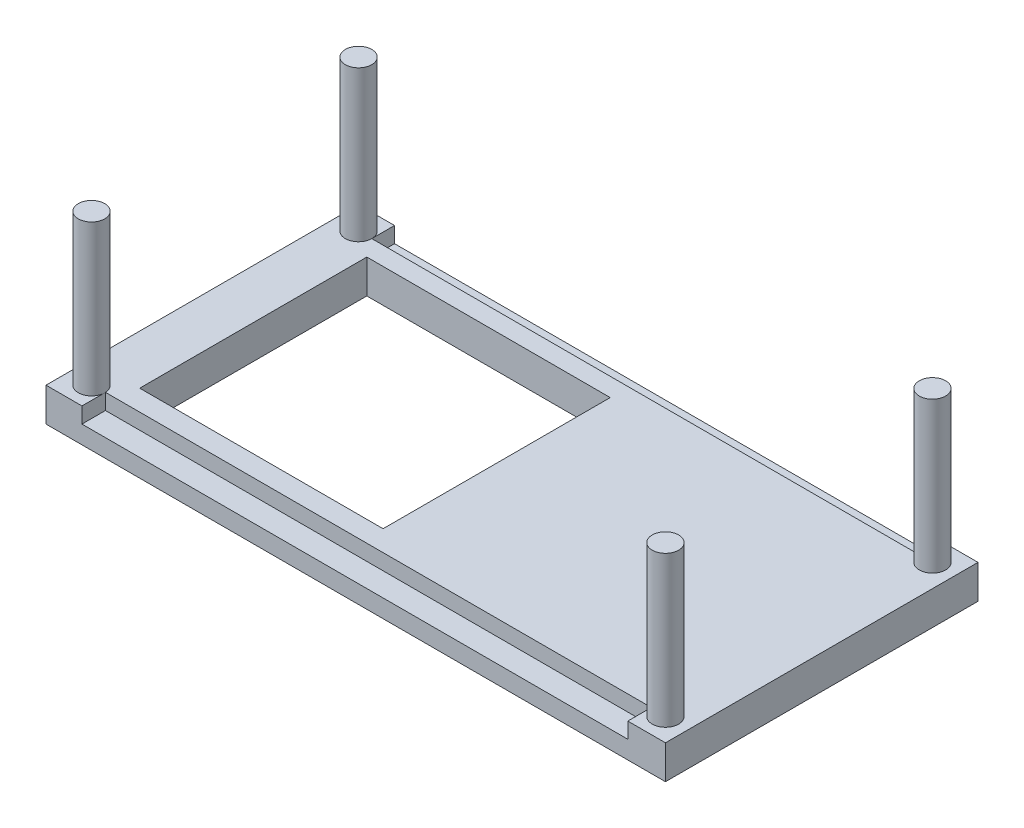
from build123d import *

# Parameters (mm, degrees)
SKETCH1_W           = 55.1
SKETCH1_H           = 27.8
BOSS_EXTRUDE1_DEPTH = 3
SKETCH2_R           = 1.175
BOSS_EXTRUDE2_DEPTH = 13.4
SKETCH3_W           = 21.65
SKETCH3_H           = 20.203759547
SKETCH3_W_2         = 17.65
SKETCH3_H_2         = 15.75
CUT_EXTRUDE1_DEPTH  = 35.945278651
SKETCH6_W           = 48.551877831
SKETCH6_H           = 2.091403142
SKETCH6_W_2         = 48.7
SKETCH6_H_2         = 4.58395526
CUT_EXTRUDE2_DEPTH  = 1.4


with BuildPart() as part:
    # Sketch1 → Boss-Extrude1 (new body)
    with BuildSketch(Plane(origin=(0, 0, 0), x_dir=(1, 0, 0), z_dir=(0, 1, 0))):
        Rectangle(SKETCH1_W, SKETCH1_H)
    extrude(amount=BOSS_EXTRUDE1_DEPTH)

    # Sketch2 → Boss-Extrude2 (add)
    with BuildSketch(Plane(origin=(0, 3, 0), x_dir=(1, 0, 0), z_dir=(0, 1, 0))):
        with Locations(Location((-25.525, 11.875, 0), (0, 0, 270))):
            Circle(SKETCH2_R)
        with Locations(Location((-25.525, -11.875, 0), (0, 0, 270))):
            Circle(SKETCH2_R)
        with Locations(Location((25.525, 11.875, 0), (0, 0, 270))):
            Circle(SKETCH2_R)
        with Locations(Location((25.525, -11.875, 0), (0, 0, 270))):
            Circle(SKETCH2_R)
    extrude(amount=BOSS_EXTRUDE2_DEPTH)

    # Sketch3 → Cut-Extrude1 (cut, through all)
    # profile 1 of 2: a face of its own
    with BuildSketch(Plane.XZ):
        with Locations((-12.325, -0.13539581)):
            Rectangle(SKETCH3_W, SKETCH3_H)
        with Locations((-12.325, -0.375)):
            Rectangle(SKETCH3_W_2, SKETCH3_H_2, mode=Mode.SUBTRACT)
    # profile 2 of 2: a face of its own
    with BuildSketch(Plane.XZ):
        with Locations((-12.325, -0.375)):
            Rectangle(SKETCH3_W_2, SKETCH3_H_2)
    extrude(amount=-CUT_EXTRUDE1_DEPTH, mode=Mode.SUBTRACT)

    # Sketch6 → Cut-Extrude2 (cut)
    with BuildSketch(Plane(origin=(0, 3, 0), x_dir=(1, 0, 0), z_dir=(0, 1, 0))):
        with Locations((-0.075938916, -12.854298429)):
            Rectangle(SKETCH6_W, SKETCH6_H)
        with Locations((0, 14.16697763)):
            Rectangle(SKETCH6_W_2, SKETCH6_H_2)
    extrude(amount=-CUT_EXTRUDE2_DEPTH, mode=Mode.SUBTRACT)


solid = part.part
